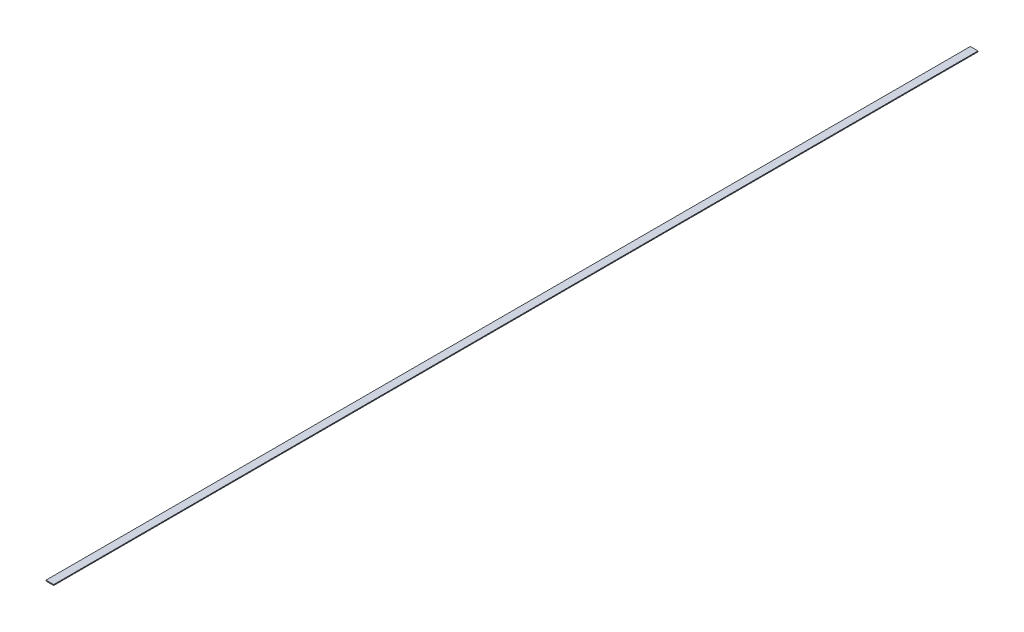
from build123d import *

# Parameters (mm, degrees)
SKETCH1_W           = 12.7
SKETCH1_H           = 1.397
BOSS_EXTRUDE1_DEPTH = 1524


with BuildPart() as part:
    # Sketch1 → Boss-Extrude1 (new body)
    with BuildSketch(Plane.XY):
        with Locations((6511.426532627, 4657.846042896)):
            Rectangle(SKETCH1_W, SKETCH1_H)
    extrude(amount=BOSS_EXTRUDE1_DEPTH)


solid = part.part
